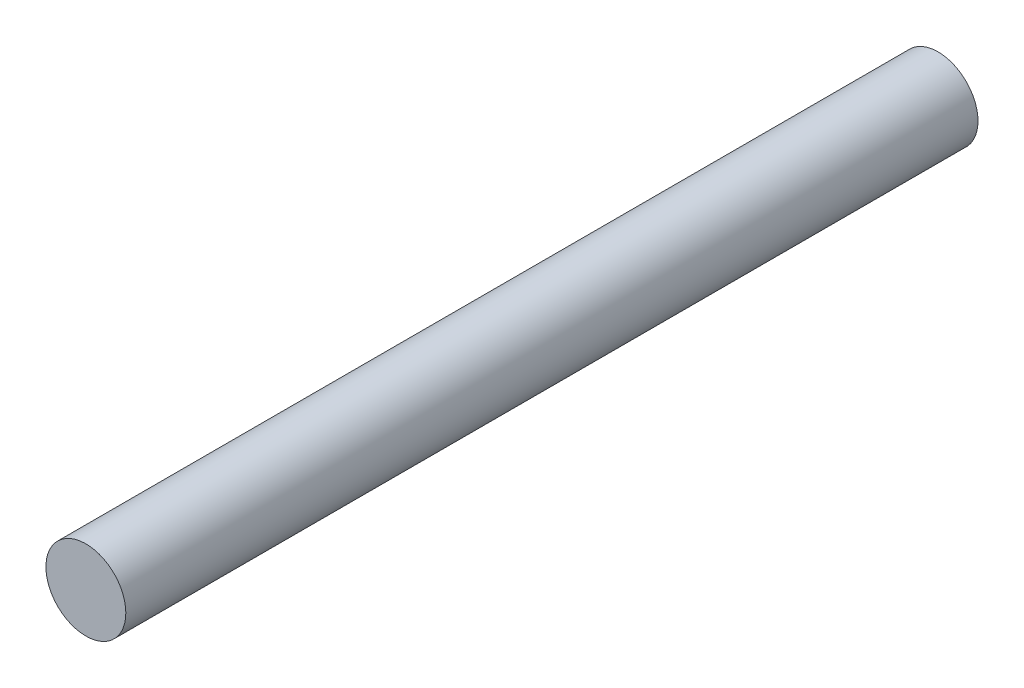
from build123d import *

# Parameters (mm, degrees)
SKETCH1_R           = 0.75
BOSS_EXTRUDE1_DEPTH = 16


with BuildPart() as part:
    # Sketch1 → Boss-Extrude1 (new body)
    with BuildSketch(Plane.XY):
        Circle(SKETCH1_R)
    extrude(amount=BOSS_EXTRUDE1_DEPTH)


with BuildPart() as part_1:
    # Body-Move/Copy1: moved
    add(part.part.moved(Location((0, 0, -16))))


solid = part_1.part
